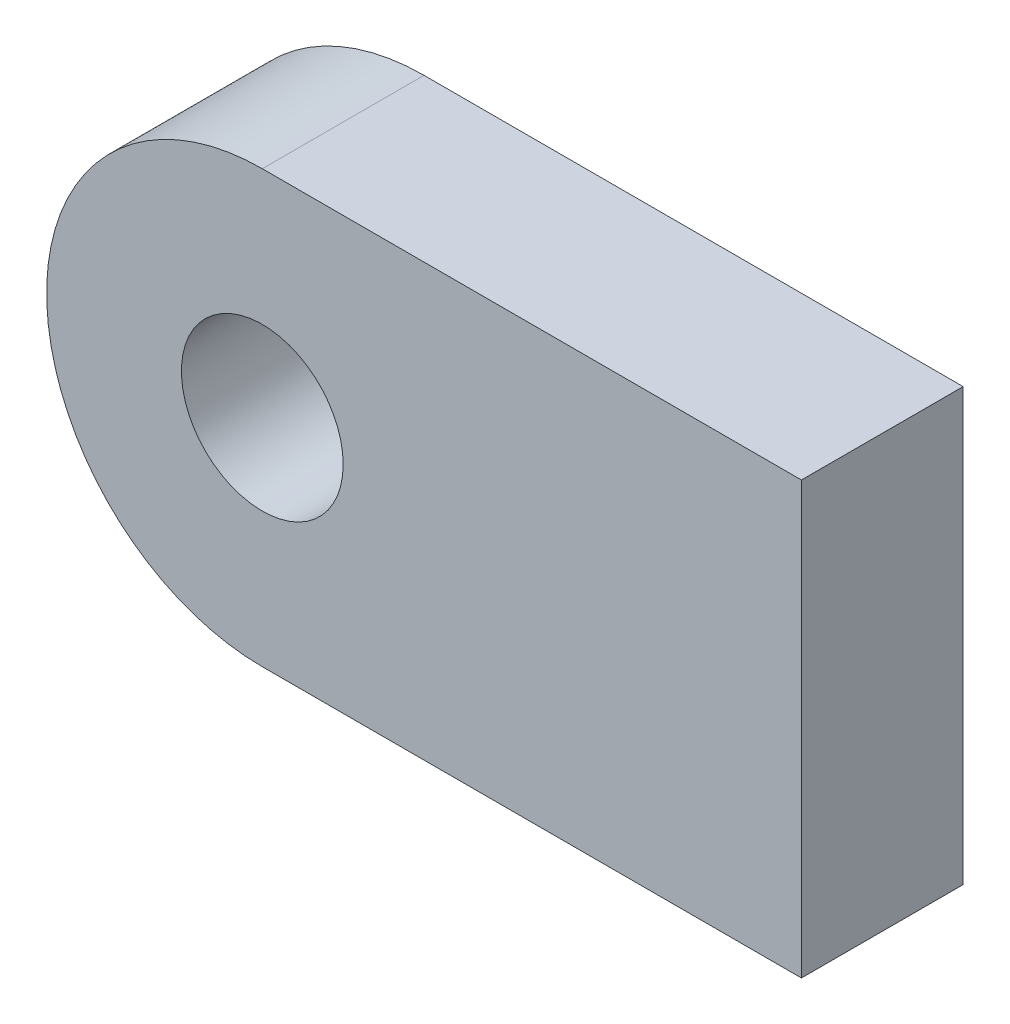
from build123d import *

# Parameters (mm, degrees)
SKETCH1_R           = 3
BOSS_EXTRUDE1_DEPTH = 6


with BuildPart() as part:
    # Sketch1 → Boss-Extrude1 (new body)
    with BuildSketch(Plane.XY):
        with BuildLine():
            Line((8.5, -1.5), (28.5, -1.5))
            Line((28.5, -1.5), (28.5, 14.5))
            Line((28.5, 14.5), (8.5, 14.5))
            ThreePointArc((8.5, 14.5), (0.5, 6.5), (8.5, -1.5))
        make_face()
        with Locations((8.5, 6.5)):
            Circle(SKETCH1_R, mode=Mode.SUBTRACT)
    extrude(amount=BOSS_EXTRUDE1_DEPTH)


solid = part.part
